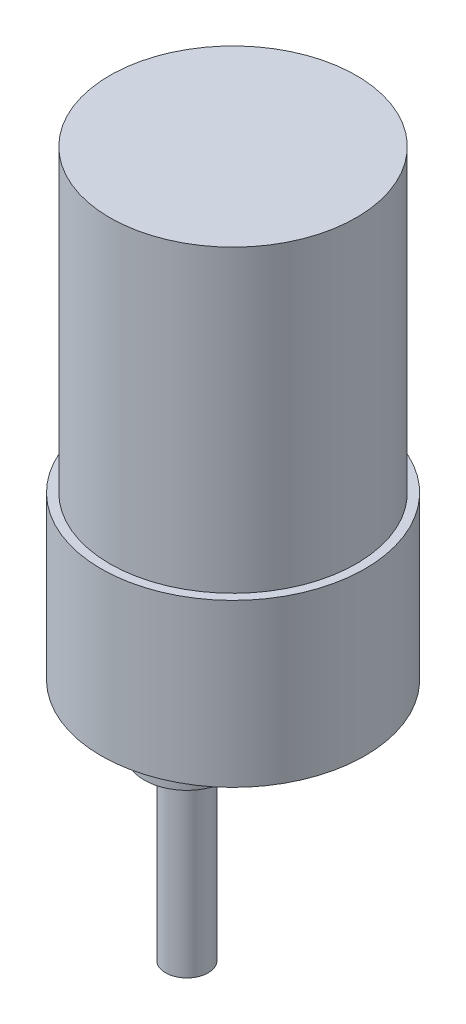
from build123d import *

# Parameters (mm, degrees)
SKETCH_1_R            = 18.575
GEAR_BOX_DEPTH        = 22.8
SKETCH_1_3_R          = 17.35
MOTOR_DEPTH           = 65
SKETCH_2_R            = 6
SKETCH_2_R_2          = 3
CU_BEARING_DEPTH      = 6
SKETCH_2_3_R          = 3
F_6MMSHAFT_DEPTH      = 31
SKETCH_2_4_R          = 1
M2_TAPPING_HOLE_DEPTH = 5


with BuildPart() as part:
    # 草图1 → gear box (new body)
    with BuildSketch(Plane(origin=(0, 0, 0), x_dir=(1, 0, 0), z_dir=(0, 1, 0))):
        Circle(SKETCH_1_R)
    extrude(amount=GEAR_BOX_DEPTH)

    # 草图1<3> → motor (add)
    with BuildSketch(Plane(origin=(0, 0, 0), x_dir=(1, 0, 0), z_dir=(0, 1, 0))):
        Circle(SKETCH_1_3_R)
    extrude(amount=MOTOR_DEPTH)

    # 草图2 → Cu bearing (add)
    with BuildSketch(Plane.XZ):
        with Locations((0, 6.5)):
            Circle(SKETCH_2_R)
        with Locations((0, 6.5)):
            Circle(SKETCH_2_R_2, mode=Mode.SUBTRACT)
    extrude(amount=CU_BEARING_DEPTH)

    # 草图2<3> → 6mmshaft (add)
    with BuildSketch(Plane.XZ):
        with Locations((0, 6.5)):
            Circle(SKETCH_2_3_R)
    extrude(amount=F_6MMSHAFT_DEPTH)

    # 草图2<4> → M2 tapping hole (cut)
    with BuildSketch(Plane.XZ):
        with Locations((14, 0)):
            Circle(SKETCH_2_4_R)
        with Locations((-14, 0)):
            Circle(SKETCH_2_4_R)
    extrude(amount=-M2_TAPPING_HOLE_DEPTH, mode=Mode.SUBTRACT)


solid = part.part
